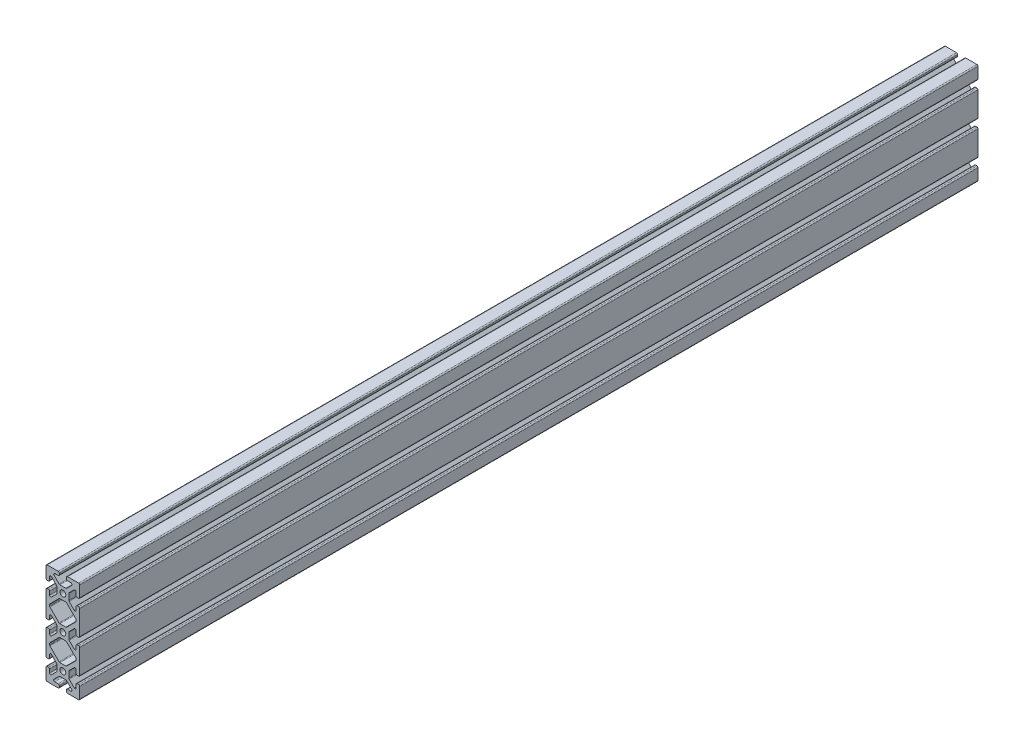
from build123d import *

# Parameters (mm, degrees)
SKETCH1_R           = 3.3274
BOSS_EXTRUDE1_DEPTH = 1016
FILLET1_R           = 1.27


with BuildPart() as part:
    # Sketch1 → Boss-Extrude1 (new body)
    with BuildSketch(Plane.XY):
        Polygon((-12.112318041, 14.986), (-3.882718041, 6.7564), (3.882718041, 6.7564), (12.112318041, 14.986), (4.064, 14.986), (4.064, 19.05), (19.05, 19.05), (19.05, 4.064), (14.986, 4.064), (14.986, 12.112318041), (6.7564, 3.882718041), (6.7564, -3.882718041), (14.986, -12.112318041), (14.986, -4.064), (19.05, -4.064), (19.05, -34.036), (14.986, -34.036), (14.986, -25.987681959), (6.7564, -34.217281959), (6.7564, -41.982718041), (14.986, -50.212318041), (14.986, -42.164), (19.05, -42.164), (19.05, -72.136), (14.986, -72.136), (14.986, -64.087681959), (6.7564, -72.317281959), (6.7564, -80.082718041), (14.986, -88.312318041), (14.986, -80.264), (19.05, -80.264), (19.05, -95.25), (4.064, -95.25), (4.064, -91.186), (12.112318041, -91.186), (3.882718041, -82.9564), (-3.882718041, -82.9564), (-12.112318041, -91.186), (-4.064, -91.186), (-4.064, -95.25), (-19.05, -95.25), (-19.05, -80.264), (-14.986, -80.264), (-14.986, -88.312318041), (-6.7564, -80.082718041), (-6.7564, -72.317281959), (-14.986, -64.087681959), (-14.986, -72.136), (-19.05, -72.136), (-19.05, -42.164), (-14.986, -42.164), (-14.986, -50.212318041), (-6.7564, -41.982718041), (-6.7564, -34.217281959), (-14.986, -25.987681959), (-14.986, -34.036), (-19.05, -34.036), (-19.05, -4.064), (-14.986, -4.064), (-14.986, -12.112318041), (-6.7564, -3.882718041), (-6.7564, 3.882718041), (-14.986, 12.112318041), (-14.986, 4.064), (-19.05, 4.064), (-19.05, 19.05), (-4.064, 19.05), (-4.064, 14.986), align=None)
        Circle(SKETCH1_R, mode=Mode.SUBTRACT)
        with Locations(Location((0, -38.1, 0), (0, 0, 180))):
            Circle(SKETCH1_R, mode=Mode.SUBTRACT)
        with Locations(Location((0, -76.2, 0), (0, 0, 180))):
            Circle(SKETCH1_R, mode=Mode.SUBTRACT)
        Polygon((-3.882718041, -6.7564), (-14.986, -17.859681959), (-14.986, -20.240318041), (-3.882718041, -31.3436), (3.882718041, -31.3436), (14.986, -20.240318041), (14.986, -17.859681959), (3.882718041, -6.7564), align=None, mode=Mode.SUBTRACT)
        Polygon((14.986, -58.340318041), (14.986, -55.959681959), (3.882718041, -44.8564), (-3.882718041, -44.8564), (-14.986, -55.959681959), (-14.986, -58.340318041), (-3.882718041, -69.4436), (3.882718041, -69.4436), align=None, mode=Mode.SUBTRACT)
    extrude(amount=BOSS_EXTRUDE1_DEPTH)

    # Fillet1
    fillet1_edges = [part.edges().sort_by_distance(p)[0] for p in [
        (-19.05, 19.05, 508),
        (-4.064, 19.05, 508),
        (-4.064, 14.986, 508),
        (-12.112318041, 14.986, 508),
        (-3.882718041, 6.7564, 508),
        (3.882718041, 6.7564, 508),
        (12.112318041, 14.986, 508),
        (4.064, 14.986, 508),
        (4.064, 19.05, 508),
        (19.05, 19.05, 508),
        (19.05, 4.064, 508),
        (14.986, 4.064, 508),
        (14.986, 12.112318041, 508),
        (6.7564, 3.882718041, 508),
        (6.7564, -3.882718041, 508),
        (14.986, -12.112318041, 508),
        (14.986, -4.064, 508),
        (19.05, -4.064, 508),
        (19.05, -34.036, 508),
        (14.986, -34.036, 508),
        (14.986, -25.987681959, 508),
        (6.7564, -34.217281959, 508),
        (6.7564, -41.982718041, 508),
        (14.986, -50.212318041, 508),
        (14.986, -42.164, 508),
        (19.05, -42.164, 508),
        (19.05, -72.136, 508),
        (14.986, -72.136, 508),
        (14.986, -64.087681959, 508),
        (6.7564, -72.317281959, 508),
        (6.7564, -80.082718041, 508),
        (14.986, -88.312318041, 508),
        (14.986, -80.264, 508),
        (19.05, -80.264, 508),
        (19.05, -95.25, 508),
        (4.064, -95.25, 508),
        (4.064, -91.186, 508),
        (12.112318041, -91.186, 508),
        (3.882718041, -82.9564, 508),
        (-3.882718041, -82.9564, 508),
        (-12.112318041, -91.186, 508),
        (-4.064, -91.186, 508),
        (-4.064, -95.25, 508),
        (-19.05, -95.25, 508),
        (-19.05, -80.264, 508),
        (-14.986, -80.264, 508),
        (-14.986, -88.312318041, 508),
        (-6.7564, -80.082718041, 508),
        (-6.7564, -72.317281959, 508),
        (-14.986, -64.087681959, 508),
        (-14.986, -72.136, 508),
        (-19.05, -72.136, 508),
        (-19.05, -42.164, 508),
        (-14.986, -42.164, 508),
        (-14.986, -50.212318041, 508),
        (-6.7564, -41.982718041, 508),
        (-6.7564, -34.217281959, 508),
        (-14.986, -25.987681959, 508),
        (-14.986, -34.036, 508),
        (-19.05, -34.036, 508),
        (-19.05, -4.064, 508),
        (-14.986, -4.064, 508),
        (-14.986, -12.112318041, 508),
        (-6.7564, -3.882718041, 508),
        (-6.7564, 3.882718041, 508),
        (-14.986, 12.112318041, 508),
        (-14.986, 4.064, 508),
        (-19.05, 4.064, 508),
        (14.986, -20.240318041, 508),
        (14.986, -17.859681959, 508),
        (3.882718041, -6.7564, 508),
        (-3.882718041, -6.7564, 508),
        (-14.986, -17.859681959, 508),
        (-14.986, -20.240318041, 508),
        (-3.882718041, -31.3436, 508),
        (3.882718041, -31.3436, 508),
        (3.882718041, -69.4436, 508),
        (14.986, -58.340318041, 508),
        (14.986, -55.959681959, 508),
        (3.882718041, -44.8564, 508),
        (-3.882718041, -44.8564, 508),
        (-14.986, -55.959681959, 508),
        (-14.986, -58.340318041, 508),
        (-3.882718041, -69.4436, 508),
    ]]
    fillet(fillet1_edges, radius=FILLET1_R)


solid = part.part
